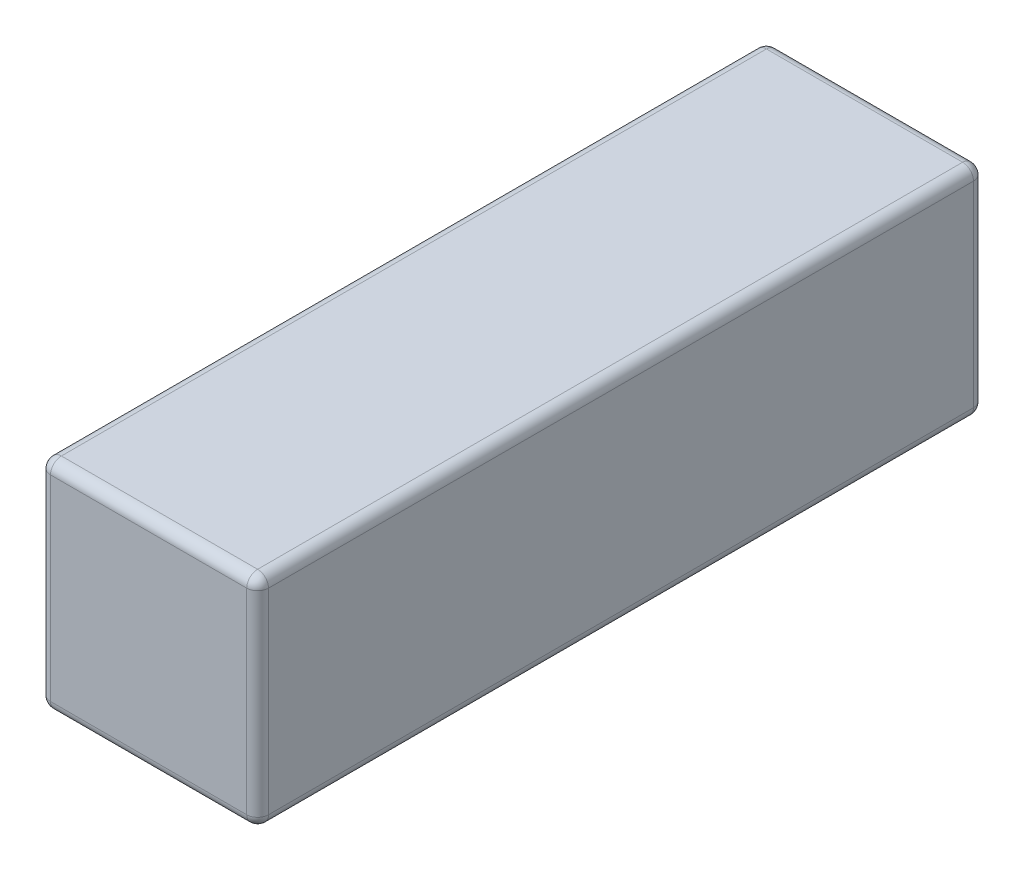
from build123d import *

# Parameters (mm, degrees)
BOSS_EXTRUDE1_DEPTH      = 6
BOSS_EXTRUDE1_DEPTH_BACK = 6
SKETCH3_W                = 3
SKETCH3_H                = 3
FILLET2_R                = 0.15
ESQUISSE1_W              = 3
ESQUISSE1_H              = 3
ENL_V_MAT_EXTRU_1_DEPTH  = 2
CONG_1_R                 = 0.15


with BuildPart() as part:
    # Sketch3 → Boss-Extrude1 (new, two sides: drawn at the far end of the back side and taken through both)
    with BuildSketch(Plane.XY.offset(-BOSS_EXTRUDE1_DEPTH_BACK)):
        Rectangle(SKETCH3_W, SKETCH3_H)
    extrude(amount=BOSS_EXTRUDE1_DEPTH + BOSS_EXTRUDE1_DEPTH_BACK)

    # Fillet2
    fillet2_edges = [part.edges().sort_by_distance(p)[0] for p in [
        (0, 1.5, 6),
        (0, -1.5, -6),
        (-1.5, 0, -6),
        (0, 1.5, -6),
        (1.5, 0, -6),
        (-1.5, 0, 6),
        (0, -1.5, 6),
        (1.5, 0, 6),
        (-1.5, -1.5, 0),
        (-1.5, 1.5, 0),
        (1.5, 1.5, 0),
        (1.5, -1.5, 0),
    ]]
    fillet(fillet2_edges, radius=FILLET2_R)

    # Esquisse1 → Enlèv. mat.-Extru.1 (cut)
    with BuildSketch(Plane.XY.offset(6)):
        Rectangle(ESQUISSE1_W, ESQUISSE1_H)
    extrude(amount=-ENL_V_MAT_EXTRU_1_DEPTH, mode=Mode.SUBTRACT)

    # Congé1
    cong_1_edges = [part.edges().sort_by_distance(p)[0] for p in [
        (-1.456066017, -1.456066017, 4),
        (1.5, 0, 4),
        (0, -1.5, 4),
        (1.456066017, 1.456066017, 4),
        (1.456066017, -1.456066017, 4),
        (-1.456066017, 1.456066017, 4),
        (-1.5, 0, 4),
        (0, 1.5, 4),
    ]]
    fillet(cong_1_edges, radius=CONG_1_R)


solid = part.part
